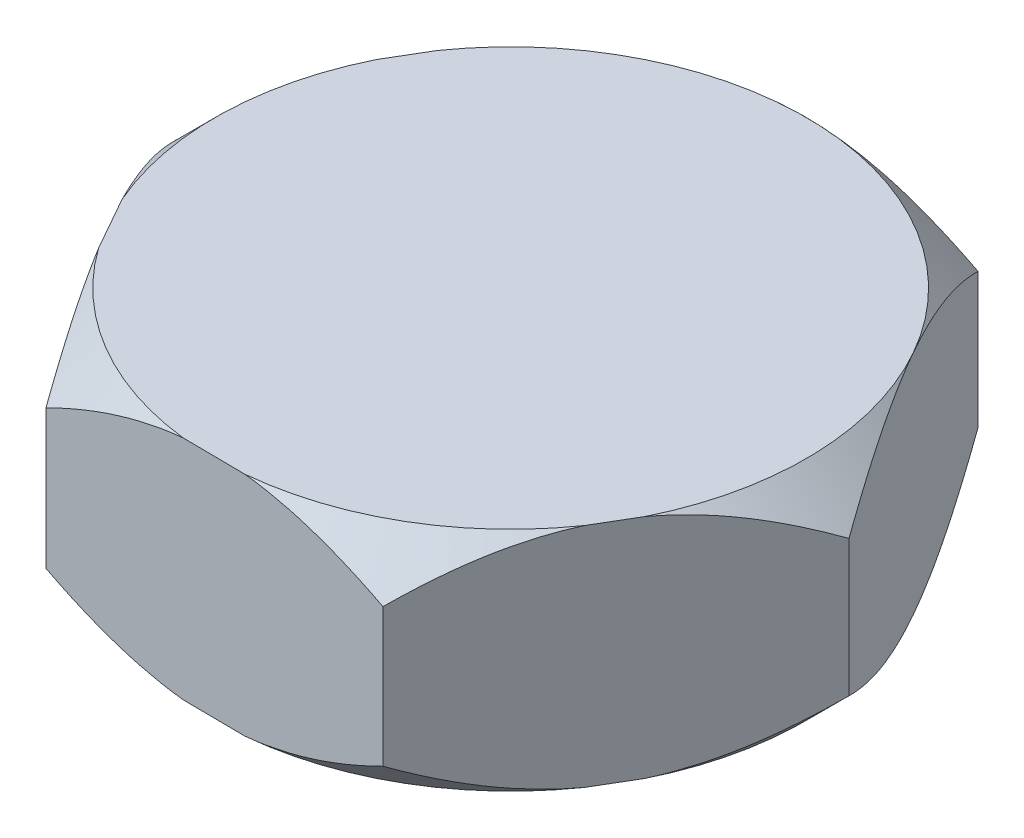
from build123d import *

# Parameters (mm, degrees)
EXTRUDE_1_DEPTH          = 1
SKETCH_2_OUTSIDE_W       = 20.56
SKETCH_2_OUTSIDE_H       = 19.785
SKETCH_2_OUTSIDE_R       = 2.605451242
CUT_EXTRUDE_1_DEPTH      = 5.459704035
CUT_EXTRUDE_1_DRAFT      = -45
MIRROR_1_COPY_1_SKETCH_W = 20.56
MIRROR_1_COPY_1_SKETCH_H = 19.785
MIRROR_1_COPY_1_SKETCH_R = 2.605451242
MIRROR_1_COPY_1_DEPTH    = 5.459704035
MIRROR_1_COPY_1_DRAFT    = -45


with BuildPart() as part:
    # 草图1 → 凸台-拉伸1 (new, symmetric)
    with BuildSketch(Plane(origin=(0, 0, 0), x_dir=(1, 0, 0), z_dir=(0, 1, 0))):
        Polygon((-1.520889796, -2.576331008), (1.479110204, -2.605355672), (3.0042463, -0.021791793), (1.529382397, 2.59079675), (-1.470617603, 2.619821415), (-2.9957537, 0.036257535), align=None)
    extrude(amount=EXTRUDE_1_DEPTH, both=True)


with BuildPart() as cut_extrude_1_tool:
    # 草图2 outside → 切除-拉伸1 (with draft: the straight prism first)
    with BuildSketch(Plane(origin=(0, 1, 0), x_dir=(1, 0, 0), z_dir=(0, 1, 0))):
        with Locations((0.004, 0.0075)):
            Rectangle(SKETCH_2_OUTSIDE_W, SKETCH_2_OUTSIDE_H)
        Circle(SKETCH_2_OUTSIDE_R, mode=Mode.SUBTRACT)
    extrude(amount=-CUT_EXTRUDE_1_DEPTH)
    # 切除-拉伸1: the draft: its side faces are tilted about the plane it starts from
    cut_extrude_1_sides = [cut_extrude_1_tool.faces().sort_by_distance(p)[0] for p in [
        (0.004, -1.729852017, 9.885),
        (10.284, -1.729852017, -0.0075),
        (0.004, -1.729852017, -9.9),
        (-10.276, -1.729852017, -0.0075),
        (-2.605451242, -1.729852017, 0),
    ]]
    draft(cut_extrude_1_sides, Plane(origin=(0, 1, 0), x_dir=(1, 0, 0), z_dir=(0, 1, 0)), CUT_EXTRUDE_1_DRAFT)


with BuildPart() as part_1:
    add(part.part)

    # 切除-拉伸1: cut by cut_extrude_1_tool
    add(cut_extrude_1_tool.part, mode=Mode.SUBTRACT)


with BuildPart() as mirror_1_copy_1_tool:
    # 镜向1 copy 1 sketch → 镜向1 copy 1 (with draft: the straight prism first)
    with BuildSketch(Plane.XZ.offset(1)):
        with Locations((0.004, -0.0075)):
            Rectangle(MIRROR_1_COPY_1_SKETCH_W, MIRROR_1_COPY_1_SKETCH_H)
        Circle(MIRROR_1_COPY_1_SKETCH_R, mode=Mode.SUBTRACT)
    extrude(amount=-MIRROR_1_COPY_1_DEPTH)
    # 镜向1 copy 1: the draft: its side faces are tilted about the plane it starts from
    mirror_1_copy_1_sides = [mirror_1_copy_1_tool.faces().sort_by_distance(p)[0] for p in [
        (0.004, 1.729852017, 9.885),
        (10.284, 1.729852017, -0.0075),
        (0.004, 1.729852017, -9.9),
        (-10.276, 1.729852017, -0.0075),
        (-2.605451242, 1.729852017, 0),
    ]]
    draft(mirror_1_copy_1_sides, Plane.XZ.offset(1), MIRROR_1_COPY_1_DRAFT)


with BuildPart() as part_2:
    add(part_1.part)

    # 镜向1 copy 1: cut by mirror_1_copy_1_tool
    add(mirror_1_copy_1_tool.part, mode=Mode.SUBTRACT)


solid = part_2.part
